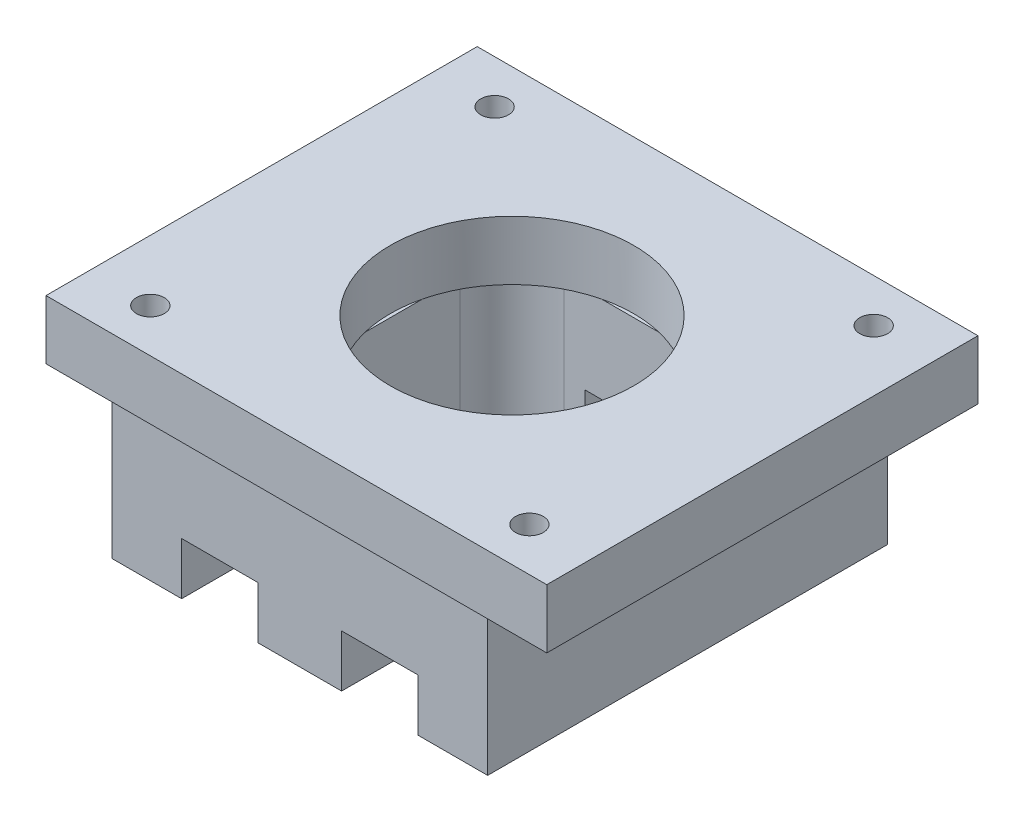
from build123d import *

# Parameters (mm, degrees)
SKETCH_1_W          = 14.4
SKETCH_1_H          = 12.4
SKETCH_1_R          = 3.5
SKETCH_1_R_2        = 0.4
EXTRUDE_1_DEPTH     = 1.7
SKETCH_2_W          = 10.8
SKETCH_2_H          = 11.5
SKETCH_2_W_2        = 6.8
SKETCH_2_H_2        = 7.5
EXTRUDE_1_2_DEPTH   = 4
FILLET_1_R          = 1.5
SKETCH_3_W          = 2.2
SKETCH_3_H          = 2
SKETCH_3_W_2        = 2.6
CUT_EXTRUDE_1_DEPTH = 1.5
SKETCH_4_R          = 0.4
CUT_EXTRUDE_2_DEPTH = 3


with BuildPart() as part:
    # 草图1 → Extrude 1 (new body)
    with BuildSketch(Plane(origin=(0, 0, 0), x_dir=(1, 0, 0), z_dir=(0, 1, 0))):
        Rectangle(SKETCH_1_W, SKETCH_1_H)
        with Locations(Location((0, 0, 0), (0, 0, 270))):
            Circle(SKETCH_1_R, mode=Mode.SUBTRACT)
        with Locations(Location((5.45, -4.95, 0), (0, 0, 270))):
            Circle(SKETCH_1_R_2, mode=Mode.SUBTRACT)
        with Locations(Location((-5.45, -4.95, 0), (0, 0, 270))):
            Circle(SKETCH_1_R_2, mode=Mode.SUBTRACT)
        with Locations(Location((5.45, 4.95, 0), (0, 0, 270))):
            Circle(SKETCH_1_R_2, mode=Mode.SUBTRACT)
        with Locations(Location((-5.45, 4.95, 0), (0, 0, 270))):
            Circle(SKETCH_1_R_2, mode=Mode.SUBTRACT)
    extrude(amount=EXTRUDE_1_DEPTH)

    # 草图2 → Extrude 1 2 (add)
    with BuildSketch(Plane.XZ):
        with Locations((0, 0.35)):
            Rectangle(SKETCH_2_W, SKETCH_2_H)
        with Locations((0, 0.35)):
            Rectangle(SKETCH_2_W_2, SKETCH_2_H_2, mode=Mode.SUBTRACT)
    extrude(amount=EXTRUDE_1_2_DEPTH)

    # 圆角1
    fillet_1_edges = [part.edges().sort_by_distance(p)[0] for p in [
        (3.4, -2, -3.4),
        (-3.4, -2, -3.4),
    ]]
    fillet(fillet_1_edges, radius=FILLET_1_R)

    # 草图3 → 切除-拉伸1 (cut)
    with BuildSketch(Plane.XZ.offset(4)):
        with Locations((-2.3, 5.1)):
            Rectangle(SKETCH_3_W, SKETCH_3_H)
        with Locations((2.3, 5.1)):
            Rectangle(SKETCH_3_W, SKETCH_3_H)
        with Locations((0, -4.4)):
            Rectangle(SKETCH_3_W_2, SKETCH_3_H)
    extrude(amount=-CUT_EXTRUDE_1_DEPTH, mode=Mode.SUBTRACT)

    # 草图4 → 切除-拉伸2 (cut)
    with BuildSketch(Plane.XZ.offset(4)):
        with Locations(Location((-3.9, -4.15, 0), (0, 0, 270))):
            Circle(SKETCH_4_R)
        with Locations(Location((3.9, -4.15, 0), (0, 0, 270))):
            Circle(SKETCH_4_R)
        with Locations(Location((0, 5.1, 0), (0, 0, 270))):
            Circle(SKETCH_4_R)
    extrude(amount=-CUT_EXTRUDE_2_DEPTH, mode=Mode.SUBTRACT)


solid = part.part
